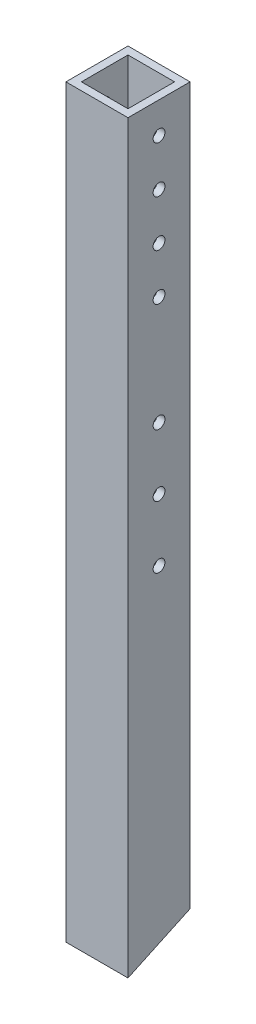
from build123d import *

# Parameters (mm, degrees)
SKETCH1_W           = 25.4
SKETCH1_H           = 25.4
SKETCH1_W_2         = 19.05
SKETCH1_H_2         = 19.05
BOSS_EXTRUDE1_DEPTH = 304.8
SKETCH2_R           = 2.413
CUT_EXTRUDE1_DEPTH  = 25.4


with BuildPart() as part:
    # Sketch1 → Boss-Extrude1 (new body)
    with BuildSketch(Plane(origin=(0, 0, 0), x_dir=(1, 0, 0), z_dir=(0, 1, 0))):
        Rectangle(SKETCH1_W, SKETCH1_H)
        Rectangle(SKETCH1_W_2, SKETCH1_H_2, mode=Mode.SUBTRACT)
    extrude(amount=BOSS_EXTRUDE1_DEPTH)

    # Sketch2 → Cut-Extrude1 (cut)
    with BuildSketch(Plane(origin=(12.7, 0, 0), x_dir=(0, 0, -1), z_dir=(1, 0, 0))):
        with Locations((0, 292.1)):
            Circle(SKETCH2_R)
        with Locations((0, 273.05)):
            Circle(SKETCH2_R)
        with Locations((0, 254)):
            Circle(SKETCH2_R)
        with Locations((0, 234.95)):
            Circle(SKETCH2_R)
        with Locations((0, 190.5)):
            Circle(SKETCH2_R)
        with Locations((0, 165.1)):
            Circle(SKETCH2_R)
        with Locations((0, 139.7)):
            Circle(SKETCH2_R)
        Polygon((-12.7, 0), (12.7, 11.844214517), (12.7, 0), align=None)
    extrude(amount=-CUT_EXTRUDE1_DEPTH, mode=Mode.SUBTRACT)


solid = part.part
